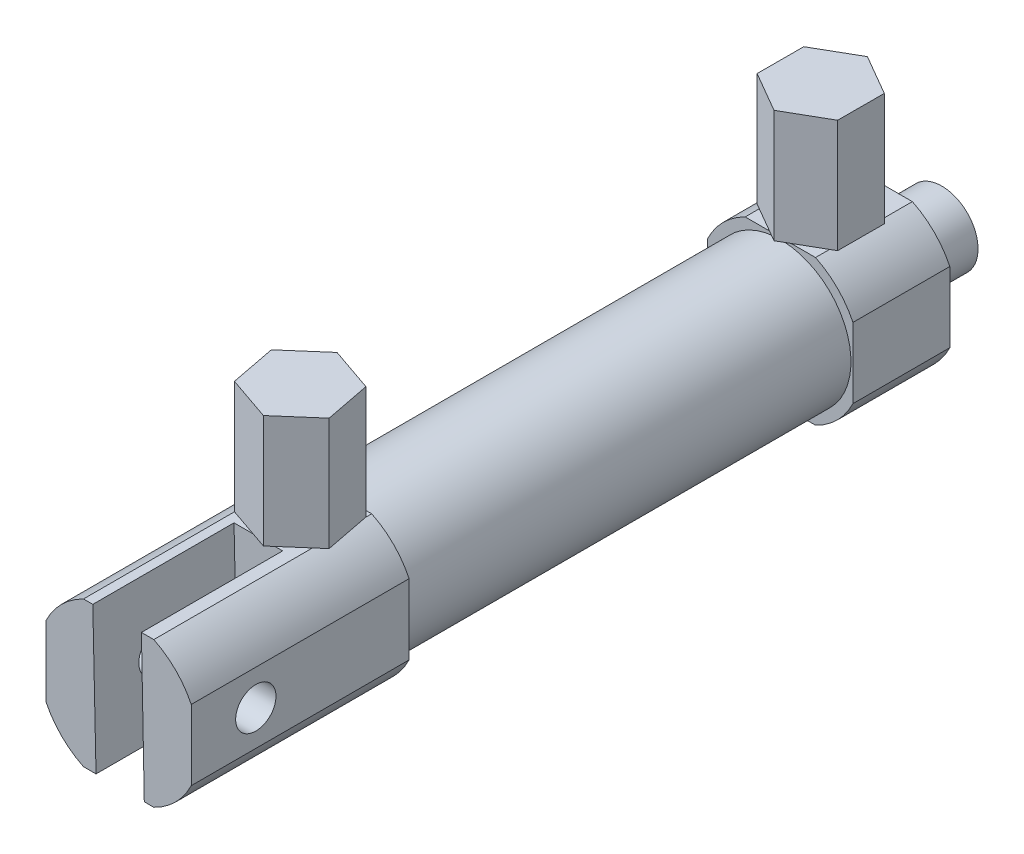
from build123d import *

# Parameters (mm, degrees)
SKETCH1_R           = 8.75
BOSS_EXTRUDE1_DEPTH = 55
SKETCH2_R           = 10
BOSS_EXTRUDE2_DEPTH = 27
BOSS_EXTRUDE3_START = 12
SKETCH3_R           = 10
BOSS_EXTRUDE3_DEPTH = 12
SKETCH4_R           = 4.5
BOSS_EXTRUDE4_DEPTH = 8
CUT_EXTRUDE1_START  = -121.5
CUT_EXTRUDE1_DEPTH  = 121.5
CUT_EXTRUDE2_START  = -17.5
CUT_EXTRUDE2_DEPTH  = 17.5
SKETCH7_R           = 2.5
CUT_EXTRUDE3_DEPTH  = 85.545845551
SKETCH8_R           = 2.5
CUT_EXTRUDE4_DEPTH  = 56.5
CUT_EXTRUDE5_START  = -133.5
CUT_EXTRUDE5_DEPTH  = 133.5
SKETCH10_R          = 1.5
CUT_EXTRUDE6_DEPTH  = 2
SKETCH11_R          = 1.5
CUT_EXTRUDE7_DEPTH  = 2
BOSS_EXTRUDE5_DEPTH = 14
BOSS_EXTRUDE6_DEPTH = 14


with BuildPart() as part:
    # Sketch1 → Boss-Extrude1 (new body)
    with BuildSketch(Plane.XY):
        Circle(SKETCH1_R)
    extrude(amount=BOSS_EXTRUDE1_DEPTH)

    # Sketch2 → Boss-Extrude2 (add)
    with BuildSketch(Plane.XY.offset(55)):
        Circle(SKETCH2_R)
    extrude(amount=BOSS_EXTRUDE2_DEPTH)

    # Sketch3 → Boss-Extrude3 (add)
    with BuildSketch(Plane(origin=(0, 0, 0), x_dir=(-1, 0, 0), z_dir=(0, 0, -1)).offset(BOSS_EXTRUDE3_START)):
        with Locations(Location((0, 0, 0), (0, 0, 180))):
            Circle(SKETCH3_R)
    extrude(amount=-BOSS_EXTRUDE3_DEPTH)

    # Sketch4 → Boss-Extrude4 (add)
    with BuildSketch(Plane(origin=(0, 0, -12), x_dir=(-1, 0, 0), z_dir=(0, 0, -1))):
        Circle(SKETCH4_R)
    extrude(amount=BOSS_EXTRUDE4_DEPTH)

    # Sketch5 → Cut-Extrude1 (cut)
    with BuildSketch(Plane.XY.offset(82).offset(CUT_EXTRUDE1_START)):
        with BuildLine():
            Line((-9, 4.358898944), (-9, -4.358898944))
            ThreePointArc((-9, -4.358898944), (-10, 0), (-9, 4.358898944))
        make_face()
        with BuildLine():
            Line((9, 4.358898944), (9, -4.358898944))
            ThreePointArc((9, -4.358898944), (10, 0), (9, 4.358898944))
        make_face()
    extrude(amount=CUT_EXTRUDE1_DEPTH, mode=Mode.SUBTRACT)

    # Sketch6 → Cut-Extrude2 (cut)
    with BuildSketch(Plane.XY.offset(82).offset(CUT_EXTRUDE2_START)):
        with BuildLine():
            Line((-3.211619504, 9.470242878), (-2.786893563, -9.603813007))
            ThreePointArc((-2.786893563, -9.603813007), (0.210299095, -9.99778847), (3.188273823, -9.478127981))
            Line((3.188273823, -9.478127981), (2.810550168, 9.596916575))
            ThreePointArc((2.810550168, 9.596916575), (-0.210299095, 9.99778847), (-3.211619504, 9.470242878))
        make_face()
    extrude(amount=CUT_EXTRUDE2_DEPTH, mode=Mode.SUBTRACT)

    # Sketch7 → Cut-Extrude3 (cut, through all)
    with BuildSketch(Plane(origin=(9, 0, 0), x_dir=(0, 0, -1), z_dir=(1, 0, 0))):
        with Locations((-74, 0)):
            Circle(SKETCH7_R)
    extrude(amount=-CUT_EXTRUDE3_DEPTH, mode=Mode.SUBTRACT)

    # Sketch8 → Cut-Extrude4 (cut)
    with BuildSketch(Plane(origin=(0, 0, -20), x_dir=(-1, 0, 0), z_dir=(0, 0, -1))):
        Circle(SKETCH8_R)
    extrude(amount=-CUT_EXTRUDE4_DEPTH, mode=Mode.SUBTRACT)

    # Sketch9 → Cut-Extrude5 (cut)
    with BuildSketch(Plane.XY.offset(82).offset(CUT_EXTRUDE5_START)):
        with BuildLine():
            Line((-4.358898944, 9), (4.358898944, 9))
            ThreePointArc((4.358898944, 9), (3.597127672, 9.330630874), (2.810550168, 9.596916575))
            ThreePointArc((2.810550168, 9.596916575), (-0.210299095, 9.99778847), (-3.211619504, 9.470242878))
            ThreePointArc((-3.211619504, 9.470242878), (-3.79255448, 9.252920108), (-4.358898944, 9))
        make_face()
        with BuildLine():
            Line((-4.358898944, -9), (4.358898944, -9))
            ThreePointArc((4.358898944, -9), (3.781151383, -9.257585766), (3.188273823, -9.478127981))
            ThreePointArc((3.188273823, -9.478127981), (0.210299095, -9.99778847), (-2.786893563, -9.603813007))
            ThreePointArc((-2.786893563, -9.603813007), (-3.585628979, -9.335055695), (-4.358898944, -9))
        make_face()
    extrude(amount=CUT_EXTRUDE5_DEPTH, mode=Mode.SUBTRACT)

    # Sketch10 → Cut-Extrude6 (cut)
    with BuildSketch(Plane(origin=(0, 9, 0), x_dir=(1, 0, 0), z_dir=(0, 1, 0))):
        with Locations(Location((0, 5, 0), (0, 0, 180))):
            Circle(SKETCH10_R)
    extrude(amount=-CUT_EXTRUDE6_DEPTH, mode=Mode.SUBTRACT)

    # Sketch11 → Cut-Extrude7 (cut)
    with BuildSketch(Plane(origin=(0, 9, 0), x_dir=(1, 0, 0), z_dir=(0, 1, 0))):
        with Locations(Location((0, -59.5, 0), (0, 0, 180))):
            Circle(SKETCH11_R)
    extrude(amount=-CUT_EXTRUDE7_DEPTH, mode=Mode.SUBTRACT)

    # Sketch13 → Boss-Extrude5 (add)
    with BuildSketch(Plane(origin=(0, 9, 0), x_dir=(1, 0, 0), z_dir=(0, 1, 0))):
        Polygon((4.993693542, 2.102352999), (5.006282685, 7.875841965), (0.012589143, 10.773488967), (-4.993693542, 7.897647001), (-5.006282685, 2.124158035), (-0.012589143, -0.773488967), align=None)
    extrude(amount=BOSS_EXTRUDE5_DEPTH)

    # Sketch14 → Boss-Extrude6 (add)
    with BuildSketch(Plane(origin=(0, 9, 0), x_dir=(1, 0, 0), z_dir=(0, 1, 0))):
        Polygon((1.10432569, -65.166903749), (5.459845453, -61.377077773), (4.355519763, -55.710174024), (-1.10432569, -53.833096251), (-5.459845453, -57.622922227), (-4.355519763, -63.289825976), align=None)
    extrude(amount=BOSS_EXTRUDE6_DEPTH)


solid = part.part
